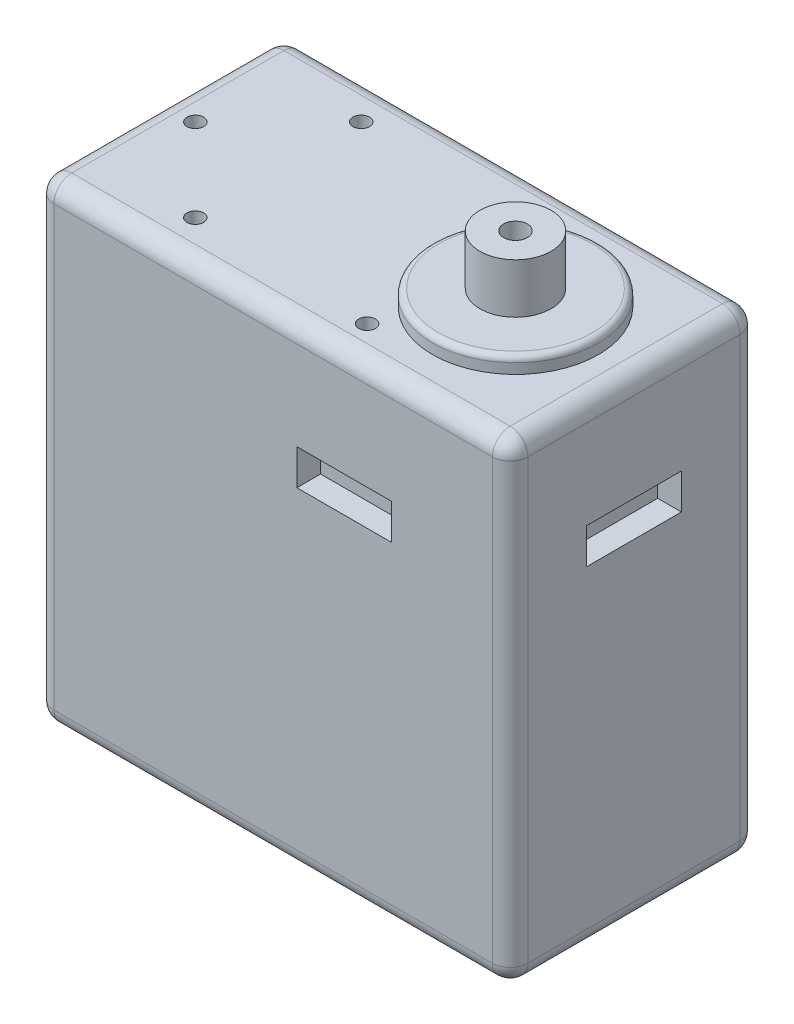
from build123d import *

# Parameters (mm, degrees)
SKETCH_1_W          = 40
SKETCH_1_H          = 40
EXTRUDE_1_DEPTH     = 20.9
SKETCH_2_W          = 8
SKETCH_2_H          = 3
CUT_EXTRUDE_1_DEPTH = 2
SKETCH_3_W          = 8
SKETCH_3_H          = 3
CUT_EXTRUDE_2_DEPTH = 2
SKETCH_4_W          = 8
SKETCH_4_H          = 3
CUT_EXTRUDE_3_DEPTH = 2
HOLE_WIZARD_1_D     = 2
HOLE_WIZARD_1_DEPTH = 5.55
HOLE_WIZARD_2_D     = 1.4
HOLE_WIZARD_2_DEPTH = 10
HOLE_WIZARD_3_D     = 2
HOLE_WIZARD_3_DEPTH = 5.55
HOLE_WIZARD_4_D     = 1.8
HOLE_WIZARD_4_DEPTH = 10
FILLET_1_R          = 0.5
FILLET_2_R          = 1.5


with BuildPart() as part:
    # 草图1 → 凸台-拉伸1 (new body)
    with BuildSketch(Plane(origin=(0, 0, -10.45), x_dir=(-1, 0, 0), z_dir=(0, 0, -1))):
        with Locations((10, 0)):
            Rectangle(SKETCH_1_W, SKETCH_1_H)
    extrude(amount=-EXTRUDE_1_DEPTH)

    # 草图2 → 切除-拉伸1 (cut)
    with BuildSketch(Plane(origin=(0, 0, -10.45), x_dir=(-1, 0, 0), z_dir=(0, 0, -1))):
        with Locations((4, 9.5)):
            Rectangle(SKETCH_2_W, SKETCH_2_H)
    extrude(amount=-CUT_EXTRUDE_1_DEPTH, mode=Mode.SUBTRACT)

    # 草图3 → 切除-拉伸2 (cut)
    with BuildSketch(Plane.XY.offset(10.45)):
        with Locations((-4, 9.5)):
            Rectangle(SKETCH_3_W, SKETCH_3_H)
    extrude(amount=-CUT_EXTRUDE_2_DEPTH, mode=Mode.SUBTRACT)

    # 草图4 → 切除-拉伸3 (cut)
    with BuildSketch(Plane(origin=(10, 0, 0), x_dir=(0, 0, -1), z_dir=(1, 0, 0))):
        with Locations((0, 9.5)):
            Rectangle(SKETCH_4_W, SKETCH_4_H)
    extrude(amount=-CUT_EXTRUDE_3_DEPTH, mode=Mode.SUBTRACT)

    # 草图5 → 旋转1 (revolve)
    with BuildSketch(Plane.XY, mode=Mode.PRIVATE) as revolve_1_sk:
        Polygon((3, 25.55), (0, 25.55), (0, 20), (7, 20), (7, 21.35), (3, 21.35), align=None)
    revolve(revolve_1_sk.sketch.rotate(Axis((0, 25.55, 0), (0, -1, 0)), 270), axis=Axis((0, 25.55, 0), (0, -1, 0)))

    # 草图6 → 旋转2 (revolve)
    with BuildSketch(Plane.XY, mode=Mode.PRIVATE) as revolve_2_sk:
        Polygon((7, -20), (0, -20), (0, -25.55), (3, -25.55), (3, -21.35), (7, -21.35), align=None)
    revolve(revolve_2_sk.sketch.rotate(Axis((0, -20, 0), (0, -1, 0)), 270), axis=Axis((0, -20, 0), (0, -1, 0)))

    # 孔1
    with Locations(Plane(origin=(0, 25.55, 0), x_dir=(1, 0, 0), z_dir=(0, 1, 0))):
        with Locations((0, 0)):
            Hole(HOLE_WIZARD_1_D / 2, depth=HOLE_WIZARD_1_DEPTH)

    # 孔2
    with Locations(Plane(origin=(0, 20, 0), x_dir=(1, 0, 0), z_dir=(0, 1, 0))):
        with Locations((-5.02, 7.5), (-5.02, -7.5), (-20.02, 7), (-20.02, -7), (-27.02, 0)):
            Hole(HOLE_WIZARD_2_D / 2, depth=HOLE_WIZARD_2_DEPTH)

    # 孔3
    with Locations(Plane(origin=(0, -25.55, 0), x_dir=(-1, 0, 0), z_dir=(0, -1, 0))):
        with Locations((0, 0)):
            Hole(HOLE_WIZARD_3_D / 2, depth=HOLE_WIZARD_3_DEPTH)

    # 孔4
    with Locations(Plane(origin=(0, -20, 0), x_dir=(-1, 0, 0), z_dir=(0, -1, 0))):
        with Locations((27.5, 7.170912723), (27.5, -7.170912723), (12.5, -7.170912723), (-7.5, -7.170912723), (-7.5, 7.170912723), (12.5, 7.170912723)):
            Hole(HOLE_WIZARD_4_D / 2, depth=HOLE_WIZARD_4_DEPTH)

    # 圆角1
    fillet_1_edges = [part.edges().sort_by_distance(p)[0] for p in [
        (0, 21.35, 7),
        (0, -21.35, 7),
    ]]
    fillet(fillet_1_edges, radius=FILLET_1_R)

    # 圆角2
    fillet_2_edges = [part.edges().sort_by_distance(p)[0] for p in [
        (10, 0, 10.45),
        (-10, -20, 10.45),
        (-30, 0, 10.45),
        (-10, -20, -10.45),
        (10, 0, -10.45),
        (-10, 20, -10.45),
        (-30, 0, -10.45),
        (-30, -20, 0),
        (10, -20, 0),
        (10, 20, 0),
        (-30, 20, 0),
        (-10, 20, 10.45),
    ]]
    fillet(fillet_2_edges, radius=FILLET_2_R)


solid = part.part
